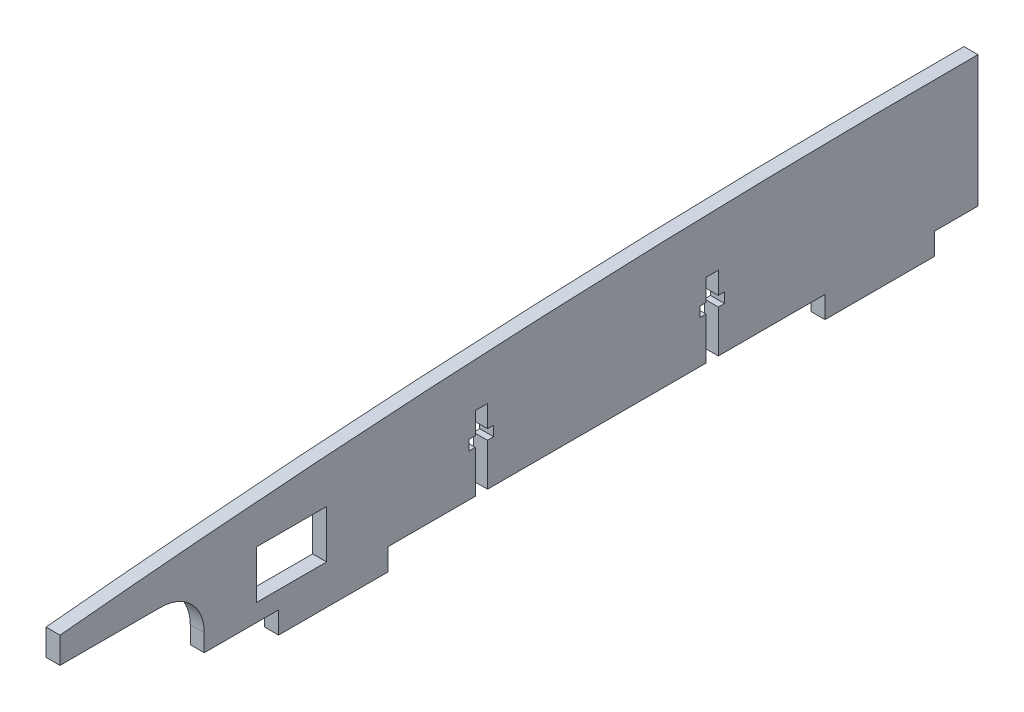
from build123d import *

# Parameters (mm, degrees)
MAIN_DEPTH        = 3.2
WHEEL_DEPTH       = 3.2
SKETCH3_W         = 25
SKETCH3_H         = 5
TABS_DEPTH        = 3.2
SCREW_HOLES_DEPTH = 3.2
SKETCH6_W         = 16
SKETCH6_H         = 11
USB_HOLE_DEPTH    = 3.2


with BuildPart() as part:
    # Sketch1 → main (new body)
    with BuildSketch(Plane(origin=(0, 0, 0), x_dir=(0, 0, -1), z_dir=(1, 0, 0))):
        with BuildLine():
            Line((-87.535437106, 0), (122.464562894, 0))
            Line((122.464562894, 0), (122.464562894, 30))
            add(Edge.make_bspline(
                [(-87.535437106, 20), (17.331032425, 30.296907598), (122.464562894, 30)],
                knots=[0, 0, 0, 1, 1, 1], degree=2))
            Line((-87.535437106, 20), (-87.535437106, 0))
        make_face()
    extrude(amount=MAIN_DEPTH)

    # Sketch2 → wheel (cut)
    with BuildSketch(Plane(origin=(3.2, 0, 0), x_dir=(0, 0, -1), z_dir=(1, 0, 0))):
        with BuildLine():
            Line((-87.535437106, 0), (-54.535437106, 0))
            Line((-54.535437106, 0), (-54.535437106, 4))
            ThreePointArc((-54.535437106, 4), (-57.464369294, 11.071067812), (-64.535437106, 14))
            Line((-64.535437106, 14), (-87.535437106, 14))
            Line((-87.535437106, 14), (-87.535437106, 0))
        make_face()
    extrude(amount=-WHEEL_DEPTH, mode=Mode.SUBTRACT)

    # Sketch3 → tabs (add)
    with BuildSketch(Plane(origin=(3.2, 0, 0), x_dir=(0, 0, -1), z_dir=(1, 0, 0))):
        with Locations((-25.035437106, -2.5)):
            Rectangle(SKETCH3_W, SKETCH3_H)
        with Locations((99.964562894, -2.5)):
            Rectangle(SKETCH3_W, SKETCH3_H)
    extrude(amount=-TABS_DEPTH)

    # Sketch5 → screw holes (cut)
    with BuildSketch(Plane(origin=(3.2, 0, 0), x_dir=(0, 0, -1), z_dir=(1, 0, 0))):
        Polygon((7.464562894, 0), (10.264562894, 0), (10.264562894, 9.7), (11.664562894, 9.7), (11.664562894, 12), (10.264562894, 12), (10.264562894, 17), (7.464562894, 17), (7.464562894, 12), (6.064562894, 12), (6.064562894, 9.7), (7.464562894, 9.7), align=None)
        Polygon((60.264562894, 0), (63.064562894, 0), (63.064562894, 9.7), (64.464562894, 9.7), (64.464562894, 12), (63.064562894, 12), (63.064562894, 17), (60.264562894, 17), (60.264562894, 12), (58.864562894, 12), (58.864562894, 9.7), (60.264562894, 9.7), align=None)
    extrude(amount=-SCREW_HOLES_DEPTH, mode=Mode.SUBTRACT)

    # Sketch6 → USB hole (cut)
    with BuildSketch(Plane(origin=(3.2, 0, 0), x_dir=(0, 0, -1), z_dir=(1, 0, 0))):
        with Locations((-34.535437106, 9.5)):
            Rectangle(SKETCH6_W, SKETCH6_H)
    extrude(amount=-USB_HOLE_DEPTH, mode=Mode.SUBTRACT)


solid = part.part
